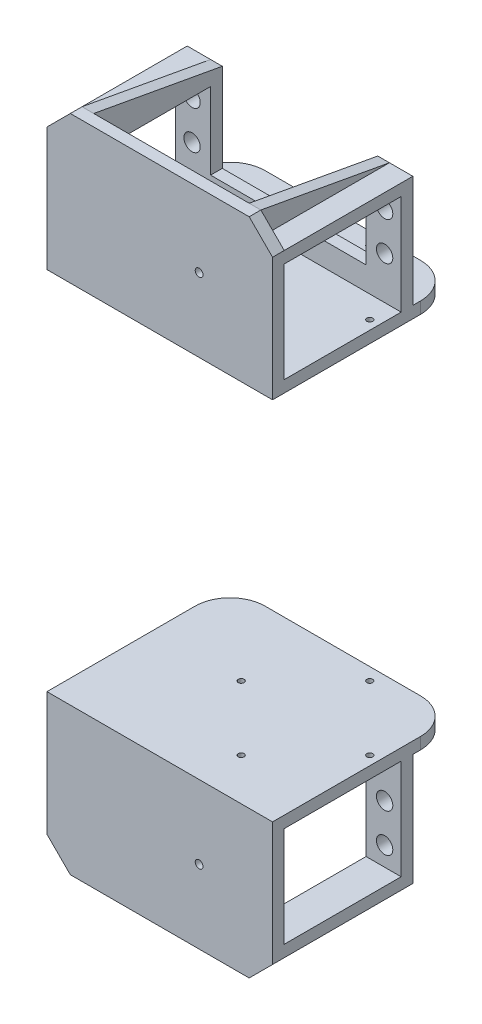
from build123d import *

# Parameters (mm, degrees)
SKETCH_1_W          = 57.9
SKETCH_1_H          = 37.7
SKETCH_1_R          = 2.1
SKETCH_1_W_2        = 39.9
SKETCH_1_H_2        = 19.7
EXTRUDE_1_DEPTH     = 3
SKETCH_2_W          = 57.9
SKETCH_2_H          = 3
EXTRUDE_2_DEPTH     = 30
SKETCH_3_R          = 1
EXTRUDE_3_DEPTH     = 3
SKETCH_9_W          = 57.9
SKETCH_9_H          = 3
EXTRUDE_4_DEPTH     = 11
SKETCH_10_R         = 0.75
CUT_EXTRUDE_3_DEPTH = 3
SKETCH_11_W         = 9
SKETCH_11_H         = 3
EXTRUDE_5_DEPTH     = 32
CUT_EXTRUDE_4_DEPTH = 9
EXTRUDE_6_DEPTH     = 3
SKETCH_17_W         = 3
SKETCH_17_H         = 33
EXTRUDE_7_DEPTH     = 6
CUT_EXTRUDE_5_DEPTH = 52


with BuildPart() as part:
    # 草图1 → 凸台-拉伸1 (new body)
    with BuildSketch(Plane.XY):
        with Locations((5.239385195, 7.436956636)):
            Rectangle(SKETCH_1_W, SKETCH_1_H)
        with Locations((-19.470614805, 12.356956636)):
            Circle(SKETCH_1_R, mode=Mode.SUBTRACT)
        with Locations((-19.470614805, 2.516956636)):
            Circle(SKETCH_1_R, mode=Mode.SUBTRACT)
        with Locations((29.949385195, 12.356956636)):
            Circle(SKETCH_1_R, mode=Mode.SUBTRACT)
        with Locations((29.949385195, 2.516956636)):
            Circle(SKETCH_1_R, mode=Mode.SUBTRACT)
        with Locations((5.239385195, 7.436956636)):
            Rectangle(SKETCH_1_W_2, SKETCH_1_H_2, mode=Mode.SUBTRACT)
    extrude(amount=EXTRUDE_1_DEPTH)

    # 草图2 → 凸台-拉伸2 (add)
    with BuildSketch(Plane.XY.offset(3)):
        with Locations((5.239385195, 24.786956636)):
            Rectangle(SKETCH_2_W, SKETCH_2_H)
    extrude(amount=EXTRUDE_2_DEPTH)

    # 草图3 → 凸台-拉伸3 (add)
    with BuildSketch(Plane.XY.offset(33)):
        Polygon((-14.710614805, 26.286956636), (-23.710614805, 26.286956636), (-23.710614805, -2.413043364), (-23.710614805, -5.413043364), (34.189385195, -5.413043364), (34.189385195, -2.413043364), (34.189385195, 26.286956636), (25.189385195, 26.286956636), align=None)
        with Locations((15.339385195, 7.436956636)):
            Circle(SKETCH_3_R, mode=Mode.SUBTRACT)
    extrude(amount=EXTRUDE_3_DEPTH)

    # 草图9 → 凸台-拉伸4 (add)
    with BuildSketch(Plane(origin=(0, 0, 0), x_dir=(-1, 0, 0), z_dir=(0, 0, -1))):
        with Locations((-5.239385195, 24.786956636)):
            Rectangle(SKETCH_9_W, SKETCH_9_H)
    extrude(amount=EXTRUDE_4_DEPTH)

    # 草图10 → 切除-拉伸3 (cut)
    with BuildSketch(Plane(origin=(0, 26.286956636, 0), x_dir=(1, 0, 0), z_dir=(0, 1, 0))):
        with Locations(Location((15.339385195, 7.8, 0), (0, 0, 270))):
            Circle(SKETCH_10_R)
        with Locations(Location((31.839385195, -8.7, 0), (0, 0, 270))):
            Circle(SKETCH_10_R)
        with Locations(Location((15.339385195, -25.2, 0), (0, 0, 270))):
            Circle(SKETCH_10_R)
        with Locations(Location((-1.160614805, -8.7, 0), (0, 0, 270))):
            Circle(SKETCH_10_R)
        with BuildLine():
            Line((-23.710614805, 2), (-23.710614805, 11))
            Line((-23.710614805, 11), (-14.710614805, 11))
            ThreePointArc((-14.710614805, 11), (-21.074575836, 8.363961031), (-23.710614805, 2))
        make_face()
        with BuildLine():
            Line((25.189385195, 11), (34.189385195, 11))
            Line((34.189385195, 11), (34.189385195, 2))
            ThreePointArc((34.189385195, 2), (31.553346226, 8.363961031), (25.189385195, 11))
        make_face()
    extrude(amount=-CUT_EXTRUDE_3_DEPTH, mode=Mode.SUBTRACT)


with BuildPart() as body_2:
    # 镜向1: mirrored copy
    add(part.part.mirror(Plane.ZX.offset(73.186956636)))


with BuildPart() as part_1:
    add(part.part)

    # 草图11 → 凸台-拉伸5 (add)
    with BuildSketch(Plane(origin=(0, 0, 33), x_dir=(-1, 0, 0), z_dir=(0, 0, -1))):
        with Locations((19.210614805, -3.913043364)):
            Rectangle(SKETCH_11_W, SKETCH_11_H)
        with Locations((-29.689385195, -3.913043364)):
            Rectangle(SKETCH_11_W, SKETCH_11_H)
    extrude(amount=EXTRUDE_5_DEPTH)

    # 草图12 → 切除-拉伸4 (cut)
    with BuildSketch(Plane(origin=(0, 0, 0), x_dir=(-1, 0, 0), z_dir=(0, 0, -1))):
        Polygon((-25.189385195, -2.413043364), (-25.189385195, -5.413043364), (-34.189385195, -5.413043364), (-34.189385195, -11.413043364), (23.710614805, -11.413043364), (23.710614805, -5.413043364), (14.710614805, -5.413043364), (14.710614805, -2.413043364), align=None)
    extrude(amount=-CUT_EXTRUDE_4_DEPTH, mode=Mode.SUBTRACT)

    # 草图13 → 凸台-拉伸6 (add)
    with BuildSketch(Plane.XY.offset(36)):
        Polygon((-23.710614805, -5.413043364), (34.189385195, -5.413043364), (28.189385195, -11.413043364), (-17.710614805, -11.413043364), align=None)
    extrude(amount=-EXTRUDE_6_DEPTH)

    # 草图17 → 凸台-拉伸7 (add)
    with BuildSketch(Plane.XZ.offset(5.413043364)):
        with Locations((-16.210614805, 16.5)):
            Rectangle(SKETCH_17_W, SKETCH_17_H)
        with Locations((26.689385195, 16.5)):
            Rectangle(SKETCH_17_W, SKETCH_17_H)
    extrude(amount=EXTRUDE_7_DEPTH)

    # 草图19 → 切除-拉伸5 (cut)
    with BuildSketch(Plane.ZY.offset(17.710614805)):
        Polygon((0, -5.413043364), (0, -11.413043364), (33, -11.413043364), align=None)
    extrude(amount=-CUT_EXTRUDE_5_DEPTH, mode=Mode.SUBTRACT)


with BuildPart() as body_2_2:
    # 镜向2: mirrored copy
    add(part_1.part.mirror(Plane.ZX.offset(73.186956636)))


solid = Compound([part_1.part, body_2_2.part])
